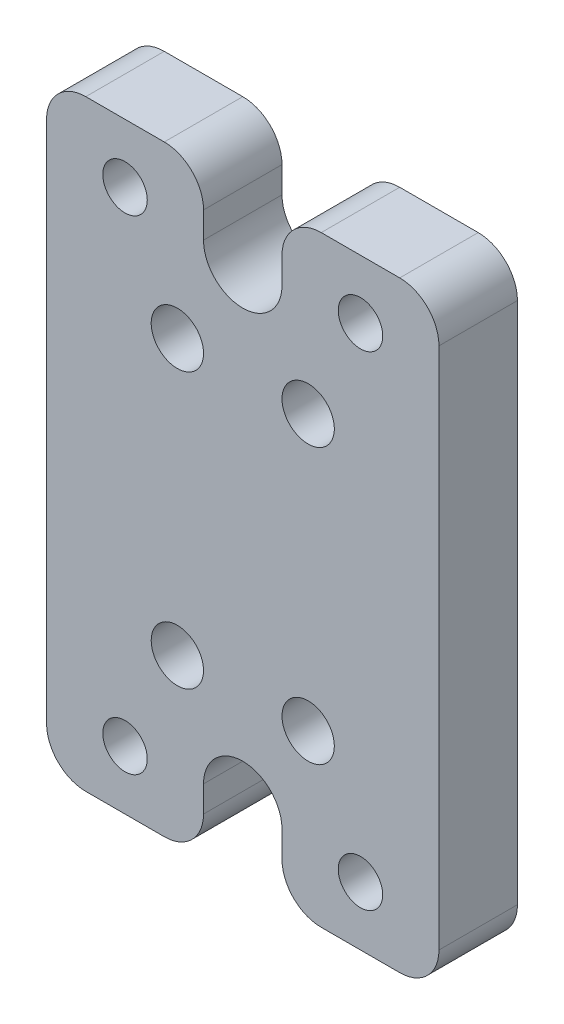
from build123d import *

# Parameters (mm, degrees)
SKETCH1_R           = 1.7
SKETCH1_R_2         = 2
BOSS_EXTRUDE1_DEPTH = 6


with BuildPart() as part:
    # Sketch1 → Boss-Extrude1 (new body)
    with BuildSketch(Plane.XY):
        with BuildLine():
            Line((-12, 23), (-6, 23))
            ThreePointArc((-6, 23), (-3.878679656, 22.121320344), (-3, 20))
            Line((-3, 20), (-3, 18))
            ThreePointArc((-3, 18), (0, 15), (3, 18))
            Line((3, 18), (3, 20))
            ThreePointArc((3, 20), (3.878679656, 22.121320344), (6, 23))
            Line((6, 23), (12, 23))
            ThreePointArc((12, 23), (14.121320344, 22.121320344), (15, 20))
            Line((15, 20), (15, -20))
            ThreePointArc((15, -20), (14.121320344, -22.121320344), (12, -23))
            Line((12, -23), (6, -23))
            ThreePointArc((6, -23), (3.878679656, -22.121320344), (3, -20))
            Line((3, -20), (3, -18))
            ThreePointArc((3, -18), (0, -15), (-3, -18))
            Line((-3, -18), (-3, -20))
            ThreePointArc((-3, -20), (-3.878679656, -22.121320344), (-6, -23))
            Line((-6, -23), (-12, -23))
            ThreePointArc((-12, -23), (-14.121320344, -22.121320344), (-15, -20))
            Line((-15, -20), (-15, 20))
            ThreePointArc((-15, 20), (-14.121320344, 22.121320344), (-12, 23))
        make_face()
        with Locations((-9, 18.5)):
            Circle(SKETCH1_R, mode=Mode.SUBTRACT)
        with Locations(Location((9, 18.5, 0), (0, 0, 180))):
            Circle(SKETCH1_R, mode=Mode.SUBTRACT)
        with Locations((9, -18.5)):
            Circle(SKETCH1_R, mode=Mode.SUBTRACT)
        with Locations(Location((-9, -18.5, 0), (0, 0, 180))):
            Circle(SKETCH1_R, mode=Mode.SUBTRACT)
        with Locations((-5, 10.5)):
            Circle(SKETCH1_R_2, mode=Mode.SUBTRACT)
        with Locations(Location((5, 10.5, 0), (0, 0, 180))):
            Circle(SKETCH1_R_2, mode=Mode.SUBTRACT)
        with Locations((5, -10.5)):
            Circle(SKETCH1_R_2, mode=Mode.SUBTRACT)
        with Locations(Location((-5, -10.5, 0), (0, 0, 180))):
            Circle(SKETCH1_R_2, mode=Mode.SUBTRACT)
    extrude(amount=BOSS_EXTRUDE1_DEPTH)


solid = part.part
